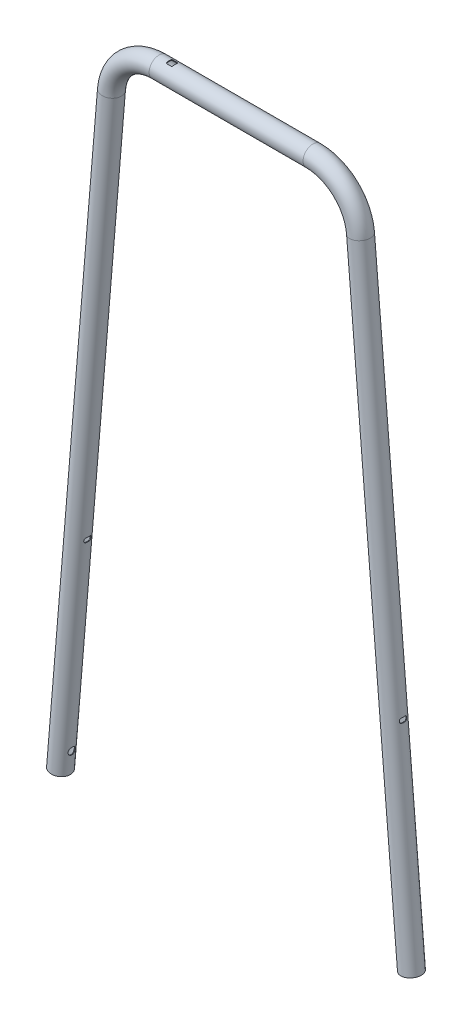
from build123d import *

# Parameters (mm, degrees)
SKETCH2_R           = 11
SKETCH2_R_2         = 10.2
SKETCH17_R          = 4
CUT_EXTRUDE6_DEPTH  = 50
CUT_EXTRUDE7_DEPTH  = 50
SKETCH19_R          = 4
CUT_EXTRUDE8_DEPTH  = 50
SKETCH20_R          = 3.5
CUT_EXTRUDE9_DEPTH  = 50
CUT_EXTRUDE10_DEPTH = 10


with BuildPart() as part:
    # Sweep2: sweep along a path in Sketch1
    with BuildLine(Plane.XY) as sweep2_path:
        Line((194.85, -162.284032228), (138.289119497, 518.40480277))
        ThreePointArc((138.289119497, 518.40480277), (121.362593539, 553.013456504), (85.471147865, 567.015967772))
        Line((85.471147865, 567.015967772), (-85.471147865, 567.015967772))
        ThreePointArc((-85.471147865, 567.015967772), (-121.362593539, 553.013456504), (-138.289119497, 518.40480277))
        Line((-138.289119497, 518.40480277), (-194.85, -162.284032228))
    # Sketch2 → Sweep2 (sweep)
    with BuildSketch(Plane(origin=(-194.85, -162.284032228, 0), x_dir=(-0.9965655024977618, 0.08280820751220104, 0), z_dir=(-0.08280820751220103, -0.9965655024977617, 0))):
        Circle(SKETCH2_R)
        Circle(SKETCH2_R_2, mode=Mode.SUBTRACT)
    sweep(path=sweep2_path.line)

    # Sketch17 → Cut-Extrude6 (cut)
    with BuildSketch(Plane(origin=(-194.85, -162.284032228, 0), x_dir=(0, 0, 1), z_dir=(-0.9965655024977617, 0.08280820751220212, 0))):
        with Locations((0, 23.8)):
            Circle(SKETCH17_R)
    cut_extrude6 = extrude(amount=-CUT_EXTRUDE6_DEPTH, mode=Mode.SUBTRACT)

    # Sketch18 → Cut-Extrude7 (cut, symmetric)
    with BuildSketch(Plane(origin=(-194.85, -162.284032228, 0), x_dir=(0, 0, 1), z_dir=(-0.9965655024977617, 0.08280820751220212, 0))):
        with BuildLine():
            Line((-2, 239.3), (2, 239.3))
            ThreePointArc((2, 239.3), (3.414213562, 238.714213562), (4, 237.3))
            Line((4, 237.3), (4, 236.3))
            ThreePointArc((4, 236.3), (3.414213562, 234.885786438), (2, 234.3))
            Line((2, 234.3), (-2, 234.3))
            ThreePointArc((-2, 234.3), (-3.414213562, 234.885786438), (-4, 236.3))
            Line((-4, 236.3), (-4, 237.3))
            ThreePointArc((-4, 237.3), (-3.414213562, 238.714213562), (-2, 239.3))
        make_face()
    cut_extrude7 = extrude(amount=CUT_EXTRUDE7_DEPTH, both=True, mode=Mode.SUBTRACT)

    # Mirror2: Cut-Extrude6, Cut-Extrude7 across plane
    add(cut_extrude6.mirror(Plane(origin=(0, 0, 0), x_dir=(0, 0, 1), z_dir=(1, 0, 0))), mode=Mode.SUBTRACT)
    add(cut_extrude7.mirror(Plane(origin=(0, 0, 0), x_dir=(0, 0, 1), z_dir=(1, 0, 0))), mode=Mode.SUBTRACT)

    # Sketch19 → Cut-Extrude8 (cut)
    with BuildSketch(Plane(origin=(-194.85, -162.284032228, 0), x_dir=(0, 0, 1), z_dir=(-0.9965655024977617, 0.08280820751220212, 0))):
        with Locations((0, 496.8)):
            Circle(SKETCH19_R)
    extrude(amount=CUT_EXTRUDE8_DEPTH, mode=Mode.SUBTRACT)

    # Sketch20 → Cut-Extrude9 (cut)
    with BuildSketch(Plane(origin=(0, 578.015967772, 0), x_dir=(1, 0, 0), z_dir=(0, 1, 0))):
        with Locations((-70.989119497, 0)):
            Circle(SKETCH20_R)
    extrude(amount=-CUT_EXTRUDE9_DEPTH, mode=Mode.SUBTRACT)

    # Sketch21 → Cut-Extrude10 (cut)
    with BuildSketch(Plane(origin=(0, 578.015967772, 0), x_dir=(1, 0, 0), z_dir=(0, 1, 0))):
        with BuildLine():
            Line((-73.489119497, -3.5), (-68.489119497, -3.5))
            ThreePointArc((-68.489119497, -3.5), (-67.782012716, -3.207106781), (-67.489119497, -2.5))
            Line((-67.489119497, -2.5), (-67.489119497, 2.5))
            ThreePointArc((-67.489119497, 2.5), (-67.782012716, 3.207106781), (-68.489119497, 3.5))
            Line((-68.489119497, 3.5), (-73.489119497, 3.5))
            ThreePointArc((-73.489119497, 3.5), (-74.196226279, 3.207106781), (-74.489119497, 2.5))
            Line((-74.489119497, 2.5), (-74.489119497, -2.5))
            ThreePointArc((-74.489119497, -2.5), (-74.196226279, -3.207106781), (-73.489119497, -3.5))
        make_face()
    extrude(amount=-CUT_EXTRUDE10_DEPTH, mode=Mode.SUBTRACT)


solid = part.part
